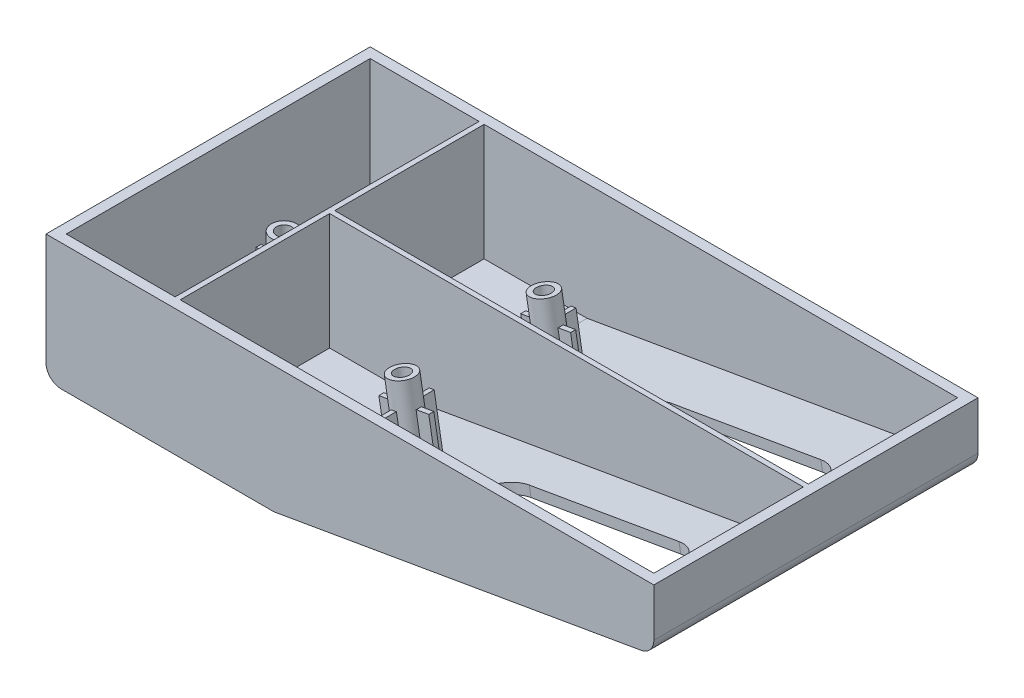
from build123d import *

# Parameters (mm, degrees)
EXTRUDE_THIN2_DEPTH = 64
RIB1_REACH          = 140.279
SKETCH2_WALL_W      = 394.557408146
SKETCH2_WALL_H      = 2
RIB2_REACH          = 139.364
SKETCH3_WALL_W      = 392.728957338
SKETCH3_WALL_H      = 2
CUT_EXTRUDE1_DEPTH  = 10
RIB9_REACH          = 120.055
SKETCH12_WALL_W     = 298.110143788
SKETCH12_WALL_H     = 1
RIB10_REACH         = 128.685
SKETCH13_WALL_W     = 348.869295694
SKETCH13_WALL_H     = 1
SKETCH14_R          = 2.5
SKETCH14_R_2        = 1.5
BOSS_EXTRUDE1_DEPTH = 15
SKETCH15_W          = 1
SKETCH15_H          = 2.550510257
SKETCH15_W_2        = 2.550510257
SKETCH15_H_2        = 1
BOSS_EXTRUDE2_DEPTH = 10
SKETCH16_R          = 2.5
SKETCH16_R_2        = 1.5
BOSS_EXTRUDE3_DEPTH = 15
SKETCH17_W          = 1
SKETCH17_H          = 2.550510257
SKETCH17_W_2        = 2.550510257
SKETCH17_H_2        = 1
BOSS_EXTRUDE4_DEPTH = 10
SKETCH18_W          = 1
SKETCH18_H          = 2.550510257
SKETCH18_W_2        = 2.550510257
SKETCH18_H_2        = 1
BOSS_EXTRUDE5_DEPTH = 10


with BuildPart() as part:
    # Sketch1 → Extrude-Thin2 (new body)
    with BuildSketch(Plane.XY):
        with BuildLine():
            Line((0, 25), (0, 3))
            ThreePointArc((0, 3), (0.878679656, 0.878679656), (3, 0))
            Line((3, 0), (45, 0))
            Line((45, 0), (117.512360171, 12.568809096))
            ThreePointArc((117.512360171, 12.568809096), (119.295330097, 13.593034489), (120, 15.524733157))
            Line((120, 15.524733157), (120, 25))
            Line((120, 25), (118, 25))
            Line((118, 25), (118, 15.524733157))
            ThreePointArc((118, 15.524733157), (117.765110032, 14.880833601), (117.170786724, 14.539425137))
            Line((117.170786724, 14.539425137), (44.827949394, 2))
            Line((44.827949394, 2), (3, 2))
            ThreePointArc((3, 2), (2.292893219, 2.292893219), (2, 3))
            Line((2, 3), (2, 25))
            Line((2, 25), (0, 25))
        make_face()
    extrude(amount=EXTRUDE_THIN2_DEPTH)

    # Sketch2 wall → Rib1 (add, up to next)
    with BuildSketch(Plane(origin=(60, 25, 0), x_dir=(1, 0, 0), z_dir=(0, 1, 0)), mode=Mode.PRIVATE) as rib1_sk1:
        with Locations((0, -1)):
            Rectangle(SKETCH2_WALL_W, SKETCH2_WALL_H)
    rib1_tool1 = extrude(rib1_sk1.sketch, amount=-RIB1_REACH, mode=Mode.PRIVATE) - part.part
    add(rib1_tool1.solids().sort_by_distance((60, 25, 0))[0])

    # Sketch3 wall → Rib2 (add, up to next)
    with BuildSketch(Plane(origin=(60, 25, 62), x_dir=(1, 0, 0), z_dir=(0, 1, 0)), mode=Mode.PRIVATE) as rib2_sk1:
        with Locations((0, -1)):
            Rectangle(SKETCH3_WALL_W, SKETCH3_WALL_H)
    rib2_tool1 = extrude(rib2_sk1.sketch, amount=-RIB2_REACH, mode=Mode.PRIVATE) - part.part
    add(rib2_tool1.solids().sort_by_distance((60, 25, 62))[0])

    # Sketch8 → Cut-Extrude1 (cut)
    with BuildSketch(Plane(origin=(0.970991275, -5.601872741, 0), x_dir=(0.9853080203996408, 0.17078672353593802, 0), z_dir=(-0.17078672353593802, 0.9853080203996408, 0))):
        with BuildLine():
            Line((72.506630536, -13), (102.506630536, -13))
            ThreePointArc((102.506630536, -13), (107.506630536, -18), (102.506630536, -23))
            Line((102.506630536, -23), (72.506630536, -23))
            ThreePointArc((72.506630536, -23), (67.506630536, -18), (72.506630536, -13))
        make_face()
        with BuildLine():
            Line((72.506630536, -41), (102.506630536, -41))
            ThreePointArc((102.506630536, -41), (107.506630536, -46), (102.506630536, -51))
            Line((102.506630536, -51), (72.506630536, -51))
            ThreePointArc((72.506630536, -51), (67.506630536, -46), (72.506630536, -41))
        make_face()
    extrude(amount=-CUT_EXTRUDE1_DEPTH, mode=Mode.SUBTRACT)

    # Sketch12 wall → Rib9 (add, up to next)
    with BuildSketch(Plane(origin=(24, 25, 32), x_dir=(0, 0, -1), z_dir=(0, 1, 0)), mode=Mode.PRIVATE) as rib9_sk1:
        Rectangle(SKETCH12_WALL_W, SKETCH12_WALL_H)
    rib9_tool1 = extrude(rib9_sk1.sketch, amount=-RIB9_REACH, mode=Mode.PRIVATE) - part.part
    add(rib9_tool1.solids().sort_by_distance((24, 25, 32))[0])

    # Sketch13 wall → Rib10 (add, up to next)
    with BuildSketch(Plane(origin=(71.25, 25, 32), x_dir=(-1, 0, 0), z_dir=(0, 1, 0)), mode=Mode.PRIVATE) as rib10_sk1:
        Rectangle(SKETCH13_WALL_W, SKETCH13_WALL_H)
    rib10_tool1 = extrude(rib10_sk1.sketch, amount=-RIB10_REACH, mode=Mode.PRIVATE) - part.part
    add(rib10_tool1.solids().sort_by_distance((71.25, 25, 32))[0])

    # Sketch14 → Boss-Extrude1 (add)
    with BuildSketch(Plane(origin=(0, 2, 0), x_dir=(1, 0, 0), z_dir=(0, 1, 0))):
        with Locations(Location((15, -32, 0), (0, 0, 270))):
            Circle(SKETCH14_R)
        with Locations(Location((15, -32, 0), (0, 0, 270))):
            Circle(SKETCH14_R_2, mode=Mode.SUBTRACT)
    extrude(amount=BOSS_EXTRUDE1_DEPTH)

    # Sketch15 → Boss-Extrude2 (add)
    with BuildSketch(Plane(origin=(0, 2, 0), x_dir=(1, 0, 0), z_dir=(0, 1, 0))):
        with Locations((15, -28.275255128)):
            Rectangle(SKETCH15_W, SKETCH15_H)
        with Locations((11.275255128, -32)):
            Rectangle(SKETCH15_W_2, SKETCH15_H_2)
        with Locations((15, -35.724744872)):
            Rectangle(SKETCH15_W, SKETCH15_H)
        with Locations((18.724744872, -32)):
            Rectangle(SKETCH15_W_2, SKETCH15_H_2)
    extrude(amount=BOSS_EXTRUDE2_DEPTH)

    # Sketch16 → Boss-Extrude3 (add)
    # profile 1 of 2: a face of its own
    with BuildSketch(Plane(origin=(0.970991275, -5.601872741, 0), x_dir=(0.9853080203996408, 0.17078672353593802, 0), z_dir=(-0.17078672353593802, 0.9853080203996408, 0))):
        with Locations(Location((54.682994606, -18, 0), (0, 0, 180))):
            Circle(SKETCH16_R)
        with Locations(Location((54.682994606, -18, 0), (0, 0, 180))):
            Circle(SKETCH16_R_2, mode=Mode.SUBTRACT)
    # profile 2 of 2: a face of its own
    with BuildSketch(Plane(origin=(0.970991275, -5.601872741, 0), x_dir=(0.9853080203996408, 0.17078672353593802, 0), z_dir=(-0.17078672353593802, 0.9853080203996408, 0))):
        with Locations(Location((54.682994606, -46, 0), (0, 0, 180))):
            Circle(SKETCH16_R)
        with Locations(Location((54.682994606, -46, 0), (0, 0, 180))):
            Circle(SKETCH16_R_2, mode=Mode.SUBTRACT)
    extrude(amount=BOSS_EXTRUDE3_DEPTH)

    # Sketch17 → Boss-Extrude4 (add)
    with BuildSketch(Plane(origin=(0.970991275, -5.601872741, 0), x_dir=(0.9853080203996408, 0.17078672353593802, 0), z_dir=(-0.17078672353593802, 0.9853080203996408, 0))):
        with Locations((54.682994606, -14.275255128)):
            Rectangle(SKETCH17_W, SKETCH17_H)
        with Locations((58.407739478, -18)):
            Rectangle(SKETCH17_W_2, SKETCH17_H_2)
        with Locations((54.682994606, -21.724744872)):
            Rectangle(SKETCH17_W, SKETCH17_H)
        with Locations((50.958249735, -18)):
            Rectangle(SKETCH17_W_2, SKETCH17_H_2)
    extrude(amount=BOSS_EXTRUDE4_DEPTH)

    # Sketch18 → Boss-Extrude5 (add)
    with BuildSketch(Plane(origin=(0.970991275, -5.601872741, 0), x_dir=(0.9853080203996408, 0.17078672353593802, 0), z_dir=(-0.17078672353593802, 0.9853080203996408, 0))):
        with Locations((54.682994606, -42.275255129)):
            Rectangle(SKETCH18_W, SKETCH18_H)
        with Locations((58.407739478, -46)):
            Rectangle(SKETCH18_W_2, SKETCH18_H_2)
        with Locations((54.682994606, -49.724744872)):
            Rectangle(SKETCH18_W, SKETCH18_H)
        with Locations((50.958249735, -46)):
            Rectangle(SKETCH18_W_2, SKETCH18_H_2)
    extrude(amount=BOSS_EXTRUDE5_DEPTH)


solid = part.part
